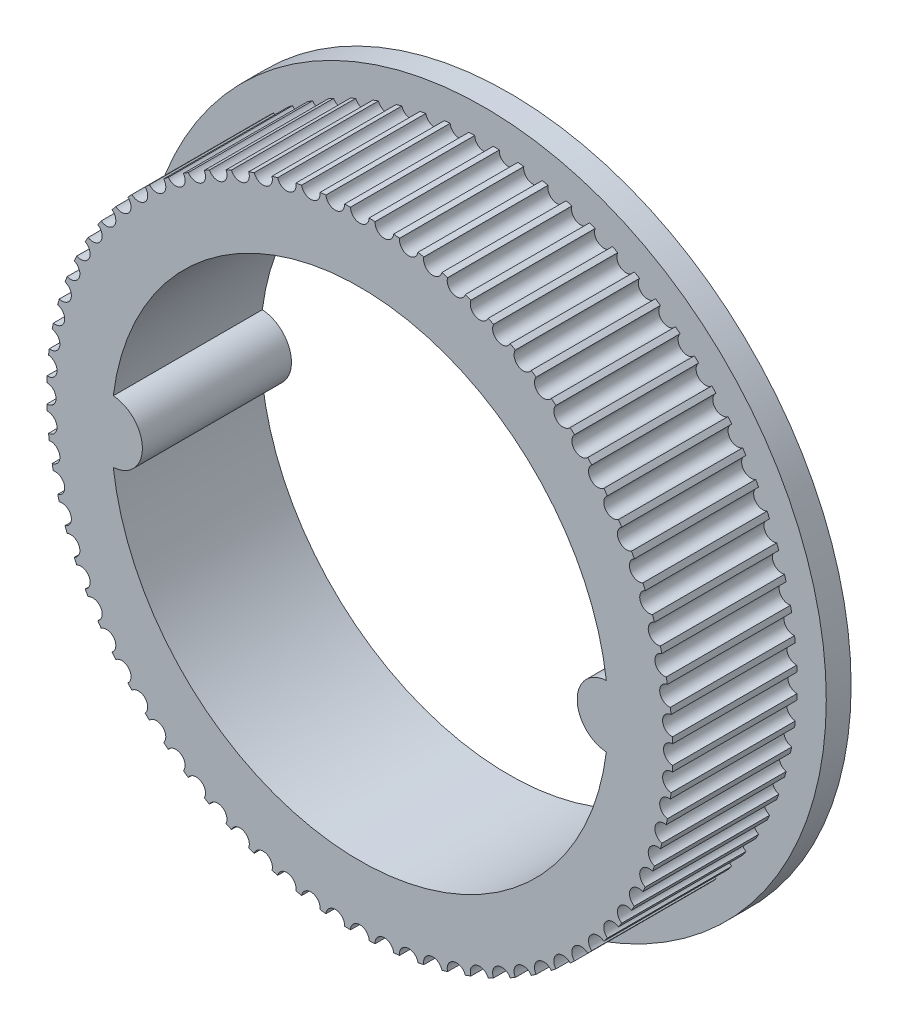
from build123d import *

# Parameters (mm, degrees)
CROQUIS1_R              = 27.55
SALIENTE_EXTRUIR1_DEPTH = 2
CROQUIS2_R              = 25.2
SALIENTE_EXTRUIR2_DEPTH = 10
CROQUIS3_R              = 20
CORTAR_EXTRUIR1_DEPTH   = 41.767695544
CROQUIS4_R              = 2.5
SALIENTE_EXTRUIR3_DEPTH = 12
CROQUIS5_R              = 0.75
CORTAR_EXTRUIR2_DEPTH   = 10


with BuildPart() as part:
    # Croquis1 → Saliente-Extruir1 (new body)
    with BuildSketch(Plane.XY):
        Circle(CROQUIS1_R)
    extrude(amount=SALIENTE_EXTRUIR1_DEPTH)

    # Croquis2 → Saliente-Extruir2 (add)
    with BuildSketch(Plane.XY.offset(2)):
        Circle(CROQUIS2_R)
    extrude(amount=SALIENTE_EXTRUIR2_DEPTH)

    # Croquis3 → Cortar-Extruir1 (cut, through all)
    with BuildSketch(Plane.XY.offset(12)):
        Circle(CROQUIS3_R)
    extrude(amount=-CORTAR_EXTRUIR1_DEPTH, mode=Mode.SUBTRACT)

    # Croquis4 → Saliente-Extruir3 (add)
    with BuildSketch(Plane.XY):
        with Locations((20, 0)):
            Circle(CROQUIS4_R)
        with Locations((-20, 0)):
            Circle(CROQUIS4_R)
    extrude(amount=SALIENTE_EXTRUIR3_DEPTH)

    # Croquis5 → Cortar-Extruir2 (cut)
    with BuildSketch(Plane.XY.offset(12)):
        with Locations((25.2, 0)):
            Circle(CROQUIS5_R)
        with Locations((25.12231681, -1.977169212)):
            Circle(CROQUIS5_R)
        with Locations((24.889746183, -3.942148519)):
            Circle(CROQUIS5_R)
        with Locations((24.503721994, -5.882823169)):
            Circle(CROQUIS5_R)
        with Locations((23.966624211, -7.787228258)):
            Circle(CROQUIS5_R)
        with Locations((23.281764219, -9.643622496)):
            Circle(CROQUIS5_R)
        with Locations((22.45336441, -11.440560593)):
            Circle(CROQUIS5_R)
        with Locations((21.486532142, -13.166963831)):
            Circle(CROQUIS5_R)
        with Locations((20.387228258, -14.812188358)):
            Circle(CROQUIS5_R)
        with Locations((19.162230333, -16.366090818)):
            Circle(CROQUIS5_R)
        with Locations((17.819090886, -17.819090886)):
            Circle(CROQUIS5_R)
        with Locations((16.366090818, -19.162230333)):
            Circle(CROQUIS5_R)
        with Locations((14.812188358, -20.387228258)):
            Circle(CROQUIS5_R)
        with Locations((13.166963831, -21.486532142)):
            Circle(CROQUIS5_R)
        with Locations((11.440560593, -22.45336441)):
            Circle(CROQUIS5_R)
        with Locations((9.643622496, -23.281764219)):
            Circle(CROQUIS5_R)
        with Locations((7.787228258, -23.966624211)):
            Circle(CROQUIS5_R)
        with Locations((5.882823169, -24.503721994)):
            Circle(CROQUIS5_R)
        with Locations((3.942148519, -24.889746183)):
            Circle(CROQUIS5_R)
        with Locations((1.977169212, -25.12231681)):
            Circle(CROQUIS5_R)
        with Locations((0, -25.2)):
            Circle(CROQUIS5_R)
        with Locations((-1.977169212, -25.12231681)):
            Circle(CROQUIS5_R)
        with Locations((-3.942148519, -24.889746183)):
            Circle(CROQUIS5_R)
        with Locations((-5.882823169, -24.503721994)):
            Circle(CROQUIS5_R)
        with Locations((-7.787228258, -23.966624211)):
            Circle(CROQUIS5_R)
        with Locations((-9.643622496, -23.281764219)):
            Circle(CROQUIS5_R)
        with Locations((-11.440560593, -22.45336441)):
            Circle(CROQUIS5_R)
        with Locations((-13.166963831, -21.486532142)):
            Circle(CROQUIS5_R)
        with Locations((-14.812188358, -20.387228258)):
            Circle(CROQUIS5_R)
        with Locations((-16.366090818, -19.162230333)):
            Circle(CROQUIS5_R)
        with Locations((-17.819090886, -17.819090886)):
            Circle(CROQUIS5_R)
        with Locations((-19.162230333, -16.366090818)):
            Circle(CROQUIS5_R)
        with Locations((-20.387228258, -14.812188358)):
            Circle(CROQUIS5_R)
        with Locations((-21.486532142, -13.166963831)):
            Circle(CROQUIS5_R)
        with Locations((-22.45336441, -11.440560593)):
            Circle(CROQUIS5_R)
        with Locations((-23.281764219, -9.643622496)):
            Circle(CROQUIS5_R)
        with Locations((-23.966624211, -7.787228258)):
            Circle(CROQUIS5_R)
        with Locations((-24.503721994, -5.882823169)):
            Circle(CROQUIS5_R)
        with Locations((-24.889746183, -3.942148519)):
            Circle(CROQUIS5_R)
        with Locations((-25.12231681, -1.977169212)):
            Circle(CROQUIS5_R)
        with Locations((-25.2, 0)):
            Circle(CROQUIS5_R)
        with Locations((-25.12231681, 1.977169212)):
            Circle(CROQUIS5_R)
        with Locations((-24.889746183, 3.942148519)):
            Circle(CROQUIS5_R)
        with Locations((-24.503721994, 5.882823169)):
            Circle(CROQUIS5_R)
        with Locations((-23.966624211, 7.787228258)):
            Circle(CROQUIS5_R)
        with Locations((-23.281764219, 9.643622496)):
            Circle(CROQUIS5_R)
        with Locations((-22.45336441, 11.440560593)):
            Circle(CROQUIS5_R)
        with Locations((-21.486532142, 13.166963831)):
            Circle(CROQUIS5_R)
        with Locations((-20.387228258, 14.812188358)):
            Circle(CROQUIS5_R)
        with Locations((-19.162230333, 16.366090818)):
            Circle(CROQUIS5_R)
        with Locations((-17.819090886, 17.819090886)):
            Circle(CROQUIS5_R)
        with Locations((-16.366090818, 19.162230333)):
            Circle(CROQUIS5_R)
        with Locations((-14.812188358, 20.387228258)):
            Circle(CROQUIS5_R)
        with Locations((-13.166963831, 21.486532142)):
            Circle(CROQUIS5_R)
        with Locations((-11.440560593, 22.45336441)):
            Circle(CROQUIS5_R)
        with Locations((-9.643622496, 23.281764219)):
            Circle(CROQUIS5_R)
        with Locations((-7.787228258, 23.966624211)):
            Circle(CROQUIS5_R)
        with Locations((-5.882823169, 24.503721994)):
            Circle(CROQUIS5_R)
        with Locations((-3.942148519, 24.889746183)):
            Circle(CROQUIS5_R)
        with Locations((-1.977169212, 25.12231681)):
            Circle(CROQUIS5_R)
        with Locations((0, 25.2)):
            Circle(CROQUIS5_R)
        with Locations((1.977169212, 25.12231681)):
            Circle(CROQUIS5_R)
        with Locations((3.942148519, 24.889746183)):
            Circle(CROQUIS5_R)
        with Locations((5.882823169, 24.503721994)):
            Circle(CROQUIS5_R)
        with Locations((7.787228258, 23.966624211)):
            Circle(CROQUIS5_R)
        with Locations((9.643622496, 23.281764219)):
            Circle(CROQUIS5_R)
        with Locations((11.440560593, 22.45336441)):
            Circle(CROQUIS5_R)
        with Locations((13.166963831, 21.486532142)):
            Circle(CROQUIS5_R)
        with Locations((14.812188358, 20.387228258)):
            Circle(CROQUIS5_R)
        with Locations((16.366090818, 19.162230333)):
            Circle(CROQUIS5_R)
        with Locations((17.819090886, 17.819090886)):
            Circle(CROQUIS5_R)
        with Locations((19.162230333, 16.366090818)):
            Circle(CROQUIS5_R)
        with Locations((20.387228258, 14.812188358)):
            Circle(CROQUIS5_R)
        with Locations((21.486532142, 13.166963831)):
            Circle(CROQUIS5_R)
        with Locations((22.45336441, 11.440560593)):
            Circle(CROQUIS5_R)
        with Locations((23.281764219, 9.643622496)):
            Circle(CROQUIS5_R)
        with Locations((23.966624211, 7.787228258)):
            Circle(CROQUIS5_R)
        with Locations((24.503721994, 5.882823169)):
            Circle(CROQUIS5_R)
        with Locations((24.889746183, 3.942148519)):
            Circle(CROQUIS5_R)
        with Locations((25.12231681, 1.977169212)):
            Circle(CROQUIS5_R)
    extrude(amount=-CORTAR_EXTRUIR2_DEPTH, mode=Mode.SUBTRACT)


solid = part.part
